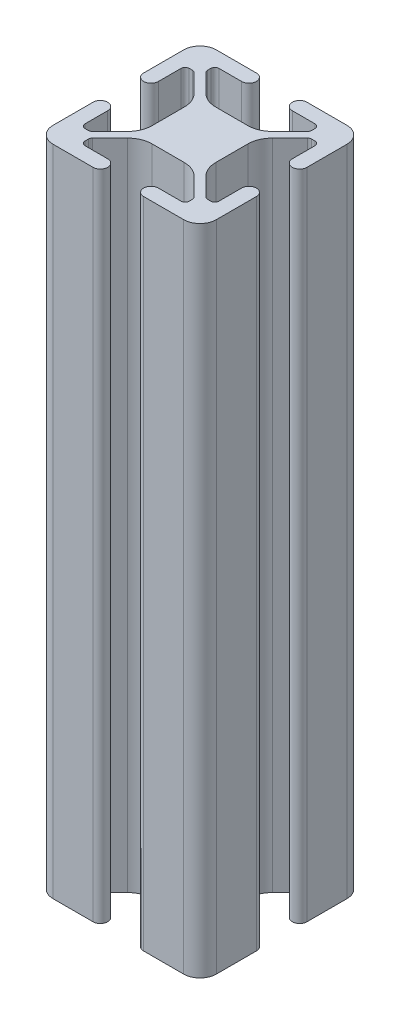
from build123d import *

# Parameters (mm, degrees)
EXTRUDE_1_DEPTH = 80


with BuildPart() as part:
    # 草图1 → 凸台-拉伸1 (new body)
    with BuildSketch(Plane(origin=(0, 0, 0), x_dir=(1, 0, 0), z_dir=(0, 1, 0))):
        with BuildLine():
            Line((-1.042752475, -10.085861632), (3.857247525, -10.085861632))
            ThreePointArc((3.857247525, -10.085861632), (4.757247525, -10.985861632), (3.857247525, -11.885861632))
            Line((3.857247525, -11.885861632), (1.076161722, -11.885861632))
            ThreePointArc((1.076161722, -11.885861632), (0.722608332, -12.032308241), (0.576161722, -12.385861632))
            Line((0.576161722, -12.385861632), (0.576161722, -12.790788968))
            ThreePointArc((0.576161722, -12.790788968), (0.614221956, -12.982130685), (0.722608332, -13.144342359))
            Line((0.722608332, -13.144342359), (2.885447948, -15.307181975))
            ThreePointArc((2.885447948, -15.307181975), (3.858717994, -15.957500229), (5.006768291, -16.185861632))
            Line((5.006768291, -16.185861632), (8.907726758, -16.185861632))
            ThreePointArc((8.907726758, -16.185861632), (10.055777055, -15.957500229), (11.029047102, -15.307181975))
            Line((11.029047102, -15.307181975), (13.191886718, -13.144342359))
            ThreePointArc((13.191886718, -13.144342359), (13.300273094, -12.982130685), (13.338333327, -12.790788968))
            Line((13.338333327, -12.790788968), (13.338333327, -12.385861632))
            ThreePointArc((13.338333327, -12.385861632), (13.191886718, -12.032308241), (12.838333327, -11.885861632))
            Line((12.838333327, -11.885861632), (10.057247525, -11.885861632))
            ThreePointArc((10.057247525, -11.885861632), (9.157247525, -10.985861632), (10.057247525, -10.085861632))
            Line((10.057247525, -10.085861632), (14.957247525, -10.085861632))
            ThreePointArc((14.957247525, -10.085861632), (16.371461087, -10.671648069), (16.957247525, -12.085861632))
            Line((16.957247525, -12.085861632), (16.957247525, -16.985861632))
            ThreePointArc((16.957247525, -16.985861632), (16.057247525, -17.885861632), (15.157247525, -16.985861632))
            Line((15.157247525, -16.985861632), (15.157247525, -14.204775829))
            ThreePointArc((15.157247525, -14.204775829), (15.010800915, -13.851222438), (14.657247525, -13.704775829))
            Line((14.657247525, -13.704775829), (14.252320188, -13.704775829))
            ThreePointArc((14.252320188, -13.704775829), (14.060978472, -13.742836063), (13.898766797, -13.851222438))
            Line((13.898766797, -13.851222438), (11.735927181, -16.014062054))
            ThreePointArc((11.735927181, -16.014062054), (11.085608927, -16.987332101), (10.857247525, -18.135382398))
            Line((10.857247525, -18.135382398), (10.857247525, -22.036340865))
            ThreePointArc((10.857247525, -22.036340865), (11.085608927, -23.184391162), (11.735927181, -24.157661209))
            Line((11.735927181, -24.157661209), (13.898766797, -26.320500825))
            ThreePointArc((13.898766797, -26.320500825), (14.060978472, -26.4288872), (14.252320188, -26.466947434))
            Line((14.252320188, -26.466947434), (14.657247525, -26.466947434))
            ThreePointArc((14.657247525, -26.466947434), (15.010800915, -26.320500825), (15.157247525, -25.966947434))
            Line((15.157247525, -25.966947434), (15.157247525, -23.185861632))
            ThreePointArc((15.157247525, -23.185861632), (16.057247525, -22.285861632), (16.957247525, -23.185861632))
            Line((16.957247525, -23.185861632), (16.957247525, -28.085861632))
            ThreePointArc((16.957247525, -28.085861632), (16.371461087, -29.500075194), (14.957247525, -30.085861632))
            Line((14.957247525, -30.085861632), (10.057247525, -30.085861632))
            ThreePointArc((10.057247525, -30.085861632), (9.157247525, -29.185861632), (10.057247525, -28.285861632))
            Line((10.057247525, -28.285861632), (12.838333327, -28.285861632))
            ThreePointArc((12.838333327, -28.285861632), (13.191886718, -28.139415022), (13.338333327, -27.785861632))
            Line((13.338333327, -27.785861632), (13.338333327, -27.380934295))
            ThreePointArc((13.338333327, -27.380934295), (13.300273094, -27.189592579), (13.191886718, -27.027380904))
            Line((13.191886718, -27.027380904), (11.029047102, -24.864541288))
            ThreePointArc((11.029047102, -24.864541288), (10.055777055, -24.214223034), (8.907726758, -23.985861632))
            Line((8.907726758, -23.985861632), (5.006768291, -23.985861632))
            ThreePointArc((5.006768291, -23.985861632), (3.858717994, -24.214223034), (2.885447948, -24.864541288))
            Line((2.885447948, -24.864541288), (0.722608332, -27.027380904))
            ThreePointArc((0.722608332, -27.027380904), (0.614221956, -27.189592579), (0.576161722, -27.380934295))
            Line((0.576161722, -27.380934295), (0.576161722, -27.785861632))
            ThreePointArc((0.576161722, -27.785861632), (0.722608332, -28.139415022), (1.076161722, -28.285861632))
            Line((1.076161722, -28.285861632), (3.857247525, -28.285861632))
            ThreePointArc((3.857247525, -28.285861632), (4.757247525, -29.185861632), (3.857247525, -30.085861632))
            Line((3.857247525, -30.085861632), (-1.042752475, -30.085861632))
            ThreePointArc((-1.042752475, -30.085861632), (-2.456966038, -29.500075194), (-3.042752475, -28.085861632))
            Line((-3.042752475, -28.085861632), (-3.042752475, -23.185861632))
            ThreePointArc((-3.042752475, -23.185861632), (-2.142752475, -22.285861632), (-1.242752475, -23.185861632))
            Line((-1.242752475, -23.185861632), (-1.242752475, -25.966947434))
            ThreePointArc((-1.242752475, -25.966947434), (-1.096305866, -26.320500825), (-0.742752475, -26.466947434))
            Line((-0.742752475, -26.466947434), (-0.337825138, -26.466947434))
            ThreePointArc((-0.337825138, -26.466947434), (-0.146483422, -26.4288872), (0.015728252, -26.320500825))
            Line((0.015728252, -26.320500825), (2.178567868, -24.157661209))
            ThreePointArc((2.178567868, -24.157661209), (2.828886122, -23.184391162), (3.057247525, -22.036340865))
            Line((3.057247525, -22.036340865), (3.057247525, -18.135382398))
            ThreePointArc((3.057247525, -18.135382398), (2.828886122, -16.987332101), (2.178567868, -16.014062054))
            Line((2.178567868, -16.014062054), (0.015728252, -13.851222438))
            ThreePointArc((0.015728252, -13.851222438), (-0.146483422, -13.742836063), (-0.337825138, -13.704775829))
            Line((-0.337825138, -13.704775829), (-0.742752475, -13.704775829))
            ThreePointArc((-0.742752475, -13.704775829), (-1.096305866, -13.851222438), (-1.242752475, -14.204775829))
            Line((-1.242752475, -14.204775829), (-1.242752475, -16.985861632))
            ThreePointArc((-1.242752475, -16.985861632), (-2.142752475, -17.885861632), (-3.042752475, -16.985861632))
            Line((-3.042752475, -16.985861632), (-3.042752475, -12.085861632))
            ThreePointArc((-3.042752475, -12.085861632), (-2.456966038, -10.671648069), (-1.042752475, -10.085861632))
        make_face()
    extrude(amount=EXTRUDE_1_DEPTH)


solid = part.part
